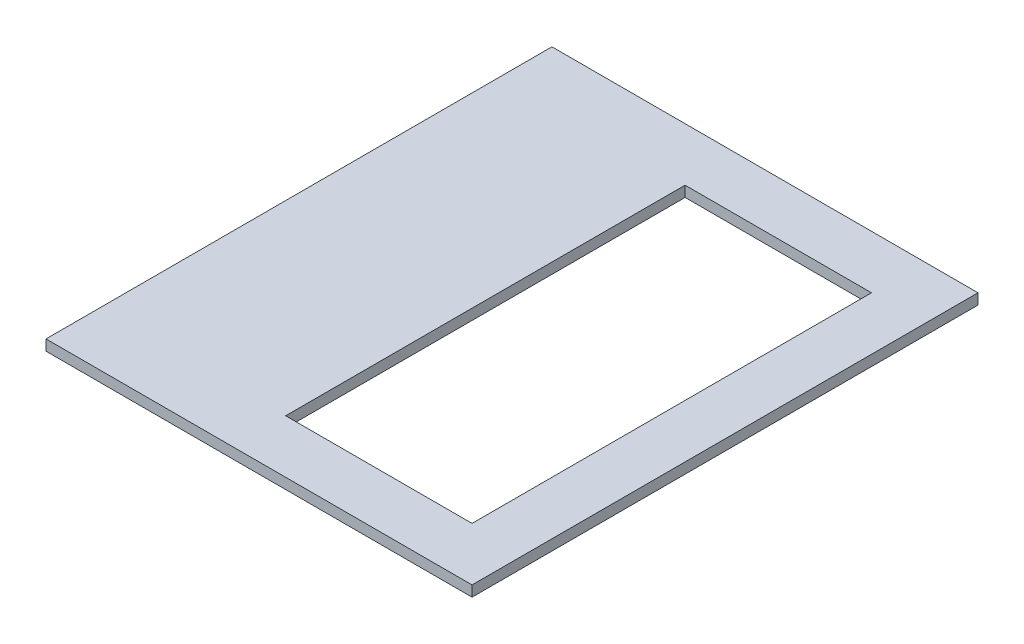
from build123d import *

# Parameters (mm, degrees)
SKETCH1_W           = 70
SKETCH1_H           = 150
BOSS_EXTRUDE1_DEPTH = 4


with BuildPart() as part:
    # Sketch1 → Boss-Extrude1 (new body)
    with BuildSketch(Plane(origin=(0, 0, 0), x_dir=(1, 0, 0), z_dir=(0, 1, 0))):
        Polygon((-55, 95), (55, 95), (55, -95), (-55, -95), (-105, -95), (-105, 95), align=None)
        Rectangle(SKETCH1_W, SKETCH1_H, mode=Mode.SUBTRACT)
    extrude(amount=BOSS_EXTRUDE1_DEPTH)


solid = part.part
